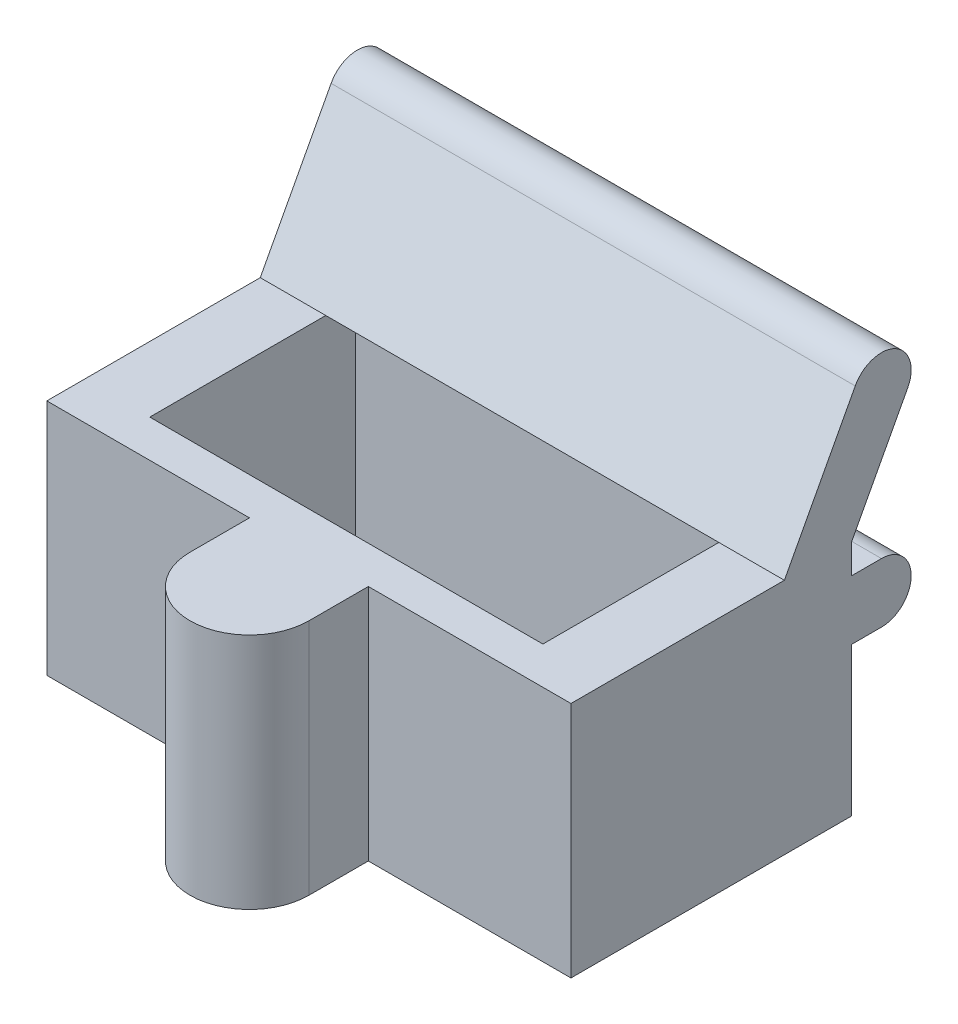
from build123d import *

# Parameters (mm, degrees)
SKETCH1_W           = 56
SKETCH1_H           = 30
SKETCH1_W_2         = 42
SKETCH1_H_2         = 22
BOSS_EXTRUDE1_DEPTH = 25.4
BOSS_EXTRUDE2_DEPTH = 56
BOSS_EXTRUDE3_REACH = 67.092
BOSS_EXTRUDE4_DEPTH = 25.4


with BuildPart() as part:
    # Sketch1 → Boss-Extrude1 (new body)
    with BuildSketch(Plane(origin=(0, 0, 0), x_dir=(1, 0, 0), z_dir=(0, 1, 0))):
        Rectangle(SKETCH1_W, SKETCH1_H)
        Rectangle(SKETCH1_W_2, SKETCH1_H_2, mode=Mode.SUBTRACT)
    extrude(amount=BOSS_EXTRUDE1_DEPTH)

    # Sketch2 → Boss-Extrude2 (add)
    with BuildSketch(Plane(origin=(28, 0, 0), x_dir=(0, 0, -1), z_dir=(1, 0, 0))):
        with BuildLine():
            Line((18.175, 22.225), (15, 22.225))
            Line((15, 22.225), (15, 15.875))
            Line((15, 15.875), (18.175, 15.875))
            ThreePointArc((18.175, 15.875), (21.35, 19.05), (18.175, 22.225))
        make_face()
    extrude(amount=-BOSS_EXTRUDE2_DEPTH)

    # Boss-Extrude3: up to this face of the body (flat: up to its plane)
    boss_extrude3_end = Plane(part.part.faces().sort_by_distance((-28, 12.986434698, -0.806465427))[0])
    # Sketch3 → Boss-Extrude3 (add, up to the picked face)
    with BuildSketch(Plane(origin=(28, 0, 0), x_dir=(0, 0, -1), z_dir=(1, 0, 0)), mode=Mode.PRIVATE) as boss_extrude3_sk1:
        with BuildLine():
            Line((15, 25.4), (20.976470588, 36.605882353))
            ThreePointArc((20.976470588, 36.605882353), (19.669117647, 40.901470588), (15.373529412, 39.594117647))
            Line((15.373529412, 39.594117647), (7.803333333, 25.4))
            Line((7.803333333, 25.4), (15, 25.4))
        make_face()
    boss_extrude3_tool1 = split(extrude(boss_extrude3_sk1.sketch, amount=-BOSS_EXTRUDE3_REACH, mode=Mode.PRIVATE), bisect_by=boss_extrude3_end, keep=Keep.BOTH, mode=Mode.PRIVATE)
    add(boss_extrude3_tool1.solids().sort_by(Axis((28, 32.888225, -15.275113), (-1, 0, 0)))[0])

    # Sketch4 → Boss-Extrude4 (add)
    with BuildSketch(Plane.XZ):
        with BuildLine():
            Line((-6.35, 21.35), (-6.35, 15))
            Line((-6.35, 15), (6.35, 15))
            Line((6.35, 15), (6.35, 21.35))
            ThreePointArc((6.35, 21.35), (0, 27.7), (-6.35, 21.35))
        make_face()
    extrude(amount=-BOSS_EXTRUDE4_DEPTH)


solid = part.part
